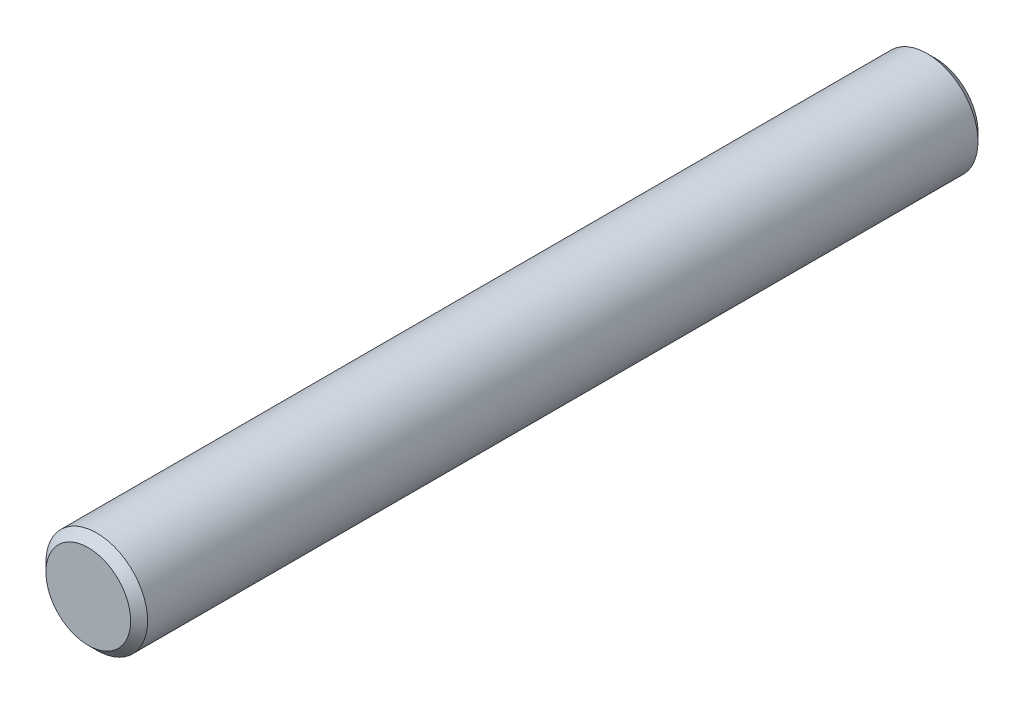
from build123d import *

# Parameters (mm, degrees)
SKETCH2_R           = 1.5
BOSS_EXTRUDE1_DEPTH = 12.5
CHAMFER1_SIZE       = 0.25


with BuildPart() as part:
    # Sketch2 → Boss-Extrude1 (new, symmetric)
    with BuildSketch(Plane.XY):
        Circle(SKETCH2_R)
    extrude(amount=BOSS_EXTRUDE1_DEPTH, both=True)

    # Chamfer1
    chamfer1_edges = [part.edges().sort_by_distance(p)[0] for p in [
        (-1.5, 0, -12.5),
        (-1.5, 0, 12.5),
    ]]
    chamfer(chamfer1_edges, length=CHAMFER1_SIZE)


solid = part.part
